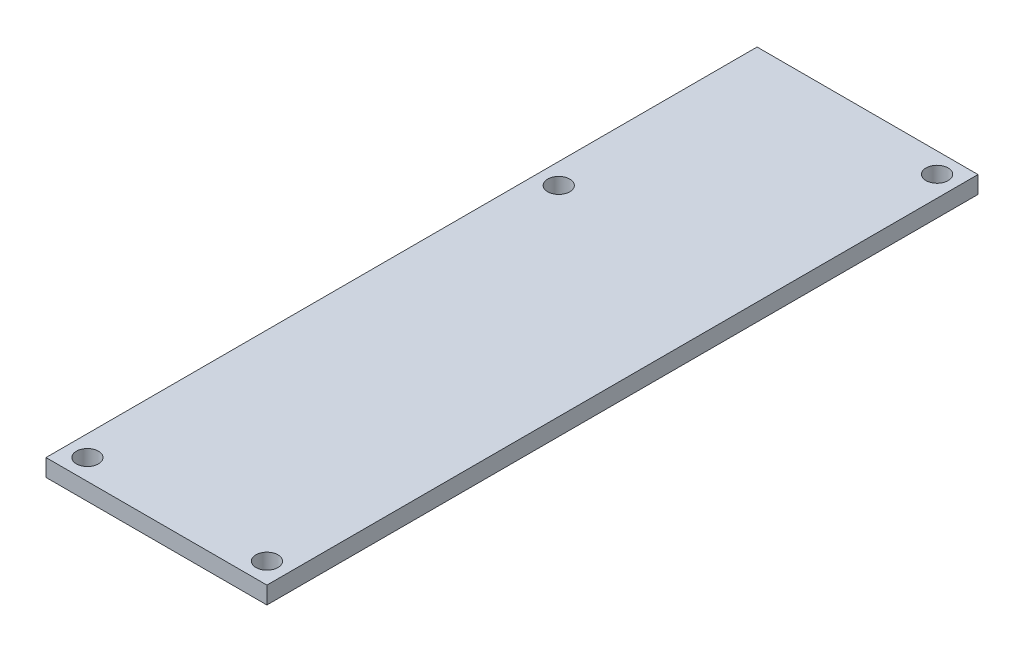
from build123d import *

# Parameters (mm, degrees)
SKETCH_1_W      = 32
SKETCH_1_H      = 103
SKETCH_1_R      = 1.6
EXTRUDE_1_DEPTH = 2.5


with BuildPart() as part:
    # 草图1 → 凸台-拉伸1 (new body)
    with BuildSketch(Plane(origin=(0, 0, 0), x_dir=(1, 0, 0), z_dir=(0, 1, 0))):
        with Locations((16, 51.5)):
            Rectangle(SKETCH_1_W, SKETCH_1_H)
        with Locations(Location((3, 3, 0), (0, 0, 270))):
            Circle(SKETCH_1_R, mode=Mode.SUBTRACT)
        with Locations(Location((29, 3, 0), (0, 0, 270))):
            Circle(SKETCH_1_R, mode=Mode.SUBTRACT)
        with Locations(Location((3, 71.27, 0), (0, 0, 270))):
            Circle(SKETCH_1_R, mode=Mode.SUBTRACT)
        with Locations(Location((29, 100.07, 0), (0, 0, 270))):
            Circle(SKETCH_1_R, mode=Mode.SUBTRACT)
    extrude(amount=EXTRUDE_1_DEPTH)


solid = part.part
